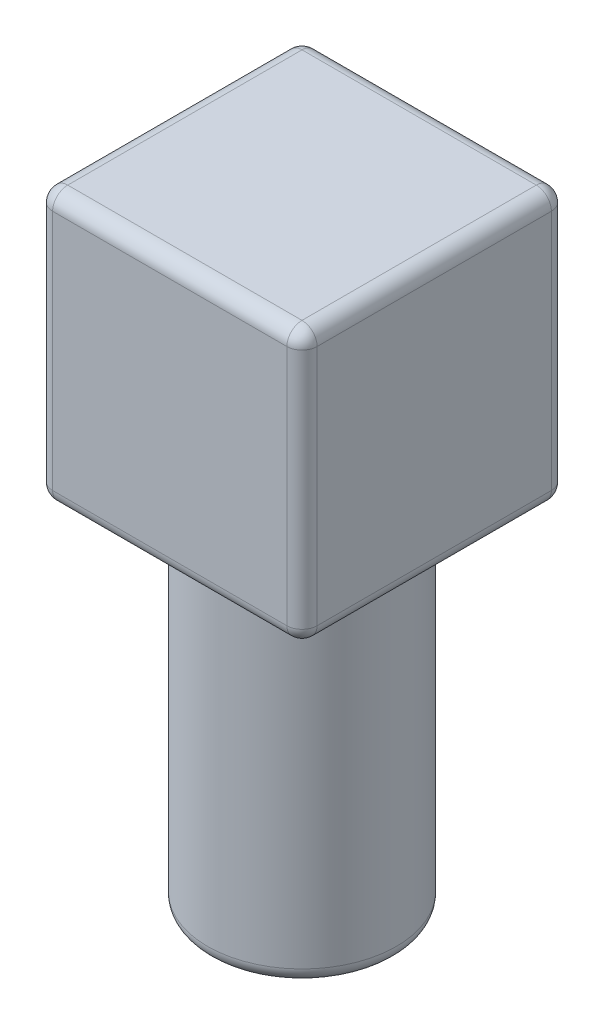
from build123d import *

# Parameters (mm, degrees)
SKETCH1_R           = 12.5
BOSS_EXTRUDE1_DEPTH = 47
SKETCH2_W           = 35
SKETCH2_H           = 35
BOSS_EXTRUDE2_DEPTH = 36
FILLET1_R           = 2


with BuildPart() as part:
    # Sketch1 → Boss-Extrude1 (new body)
    with BuildSketch(Plane(origin=(0, 0, 0), x_dir=(1, 0, 0), z_dir=(0, 1, 0))):
        with Locations(Location((0, 0, 0), (0, 0, 270))):
            Circle(SKETCH1_R)
    extrude(amount=BOSS_EXTRUDE1_DEPTH)

    # Sketch2 → Boss-Extrude2 (add)
    with BuildSketch(Plane(origin=(0, 47, 0), x_dir=(1, 0, 0), z_dir=(0, 1, 0))):
        Rectangle(SKETCH2_W, SKETCH2_H)
    extrude(amount=BOSS_EXTRUDE2_DEPTH)

    # Fillet1
    fillet1_edges = [part.edges().sort_by_distance(p)[0] for p in [
        (0, 0, -12.5),
        (-17.5, 83, 0),
        (-17.5, 65, -17.5),
        (0, 47, 17.5),
        (-17.5, 65, 17.5),
        (17.5, 47, 0),
        (17.5, 65, 17.5),
        (0, 83, -17.5),
        (17.5, 65, -17.5),
        (0, 83, 17.5),
        (17.5, 83, 0),
        (-17.5, 47, 0),
        (0, 47, -17.5),
    ]]
    fillet(fillet1_edges, radius=FILLET1_R)


solid = part.part
